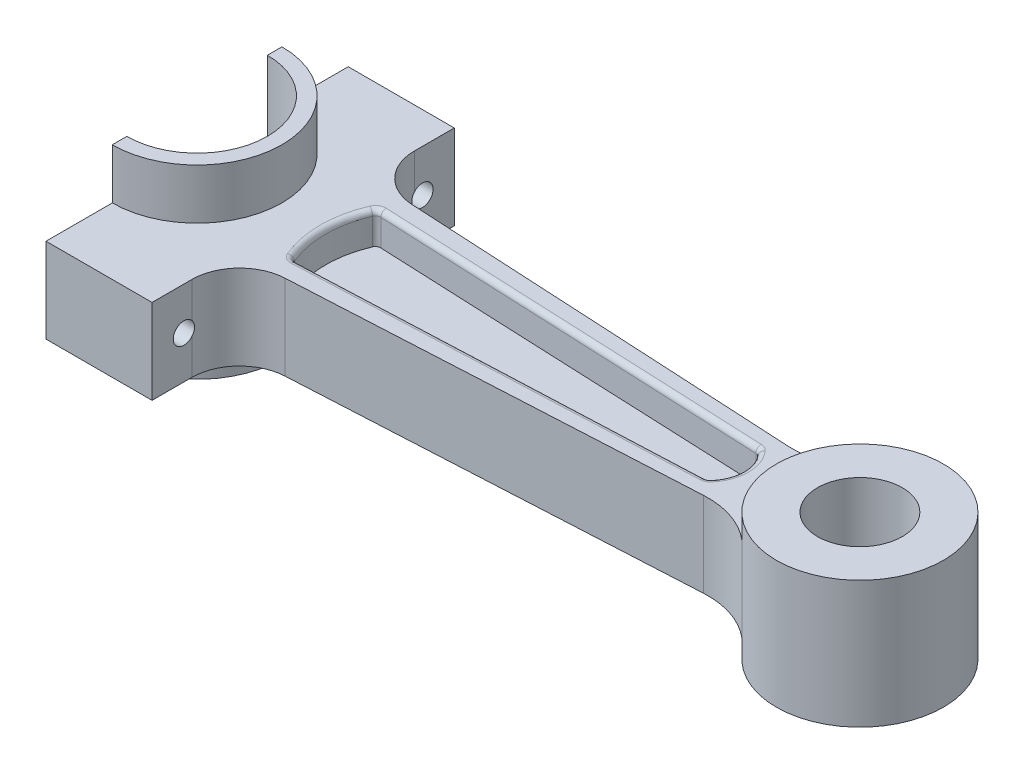
from build123d import *

# Parameters (mm, degrees)
BOSS_EXTRUDE1_DEPTH = 16
SKETCH1_5_R         = 16
BOSS_EXTRUDE2_DEPTH = 24
BOSS_EXTRUDE3_DEPTH = 35
CUT_EXTRUDE1_DEPTH  = 12
FILLET1_R           = 2
FILLET3_R           = 2
SKETCH6_R           = 4
CUT_EXTRUDE4_DEPTH  = 290.336969647


with BuildPart() as part:
    # Sketch1 → Boss-Extrude1 (new, symmetric)
    with BuildSketch(Plane(origin=(0, 0, 0), x_dir=(1, 0, 0), z_dir=(0, 1, 0))):
        with BuildLine():
            Line((-19.774827182, 56.996771876), (-19.774827182, 32))
            ThreePointArc((-19.774827182, 32), (12.225172818, 0), (-19.774827182, -32))
            Line((-19.774827182, -32), (-19.774827182, -56.996771876))
            Line((-19.774827182, -56.996771876), (20.225172818, -56.996771876))
            Line((20.225172818, -56.996771876), (20.225172818, -41.996771876))
            ThreePointArc((20.225172818, -41.996771876), (25.16884807, -29.597039719), (37.287694094, -24))
            Line((37.287694094, -24), (187.287694094, -16))
            ThreePointArc((187.287694094, -16), (199.120008212, -17.668601393), (209.448964206, -23.676975223))
            ThreePointArc((209.448964206, -23.676975223), (198.725172818, 0), (209.448964206, 23.676975223))
            ThreePointArc((209.448964206, 23.676975223), (199.120008212, 17.668601393), (187.287694094, 16))
            Line((187.287694094, 16), (37.287694094, 24))
            ThreePointArc((37.287694094, 24), (25.16884807, 29.597039719), (20.225172818, 41.996771876))
            Line((20.225172818, 41.996771876), (20.225172818, 56.996771876))
            Line((20.225172818, 56.996771876), (-19.774827182, 56.996771876))
        make_face()
    extrude(amount=BOSS_EXTRUDE1_DEPTH, both=True)

    # Sketch1<5> → Boss-Extrude2 (add, symmetric)
    with BuildSketch(Plane(origin=(0, 0, 0), x_dir=(1, 0, 0), z_dir=(0, 1, 0))):
        with BuildLine():
            ThreePointArc((261.725172818, 0), (243.221315105, 28.694081021), (209.448964206, 23.676975223))
            ThreePointArc((209.448964206, 23.676975223), (198.725172818, 0), (209.448964206, -23.676975223))
            ThreePointArc((209.448964206, -23.676975223), (243.221315105, -28.694081021), (261.725172818, 0))
        make_face()
        with Locations((230.225172818, 0)):
            Circle(SKETCH1_5_R, mode=Mode.SUBTRACT)
    extrude(amount=BOSS_EXTRUDE2_DEPTH, both=True)

    # Sketch1<6> → Boss-Extrude3 (add, symmetric)
    with BuildSketch(Plane(origin=(0, 0, 0), x_dir=(1, 0, 0), z_dir=(0, 1, 0))):
        with BuildLine():
            Line((-19.774827182, 32), (-19.774827182, 26.5))
            ThreePointArc((-19.774827182, 26.5), (6.725172818, 0), (-19.774827182, -26.5))
            Line((-19.774827182, -26.5), (-19.774827182, -32))
            ThreePointArc((-19.774827182, -32), (12.225172818, 0), (-19.774827182, 32))
        make_face()
    extrude(amount=BOSS_EXTRUDE3_DEPTH, both=True)

    # Sketch4 → Cut-Extrude1 (cut)
    with BuildSketch(Plane(origin=(0, 16, 0), x_dir=(1, 0, 0), z_dir=(0, 1, 0))):
        with BuildLine():
            Line((32.225172818, -16.001877998), (182.225172818, -9.501877998))
            ThreePointArc((182.225172818, -9.501877998), (186.160979553, 0), (182.225172818, 9.501877998))
            Line((182.225172818, 9.501877998), (32.225172818, 16.001877998))
            ThreePointArc((32.225172818, 16.001877998), (28.665381057, 0), (32.225172818, -16.001877998))
        make_face()
    cut_extrude1 = extrude(amount=-CUT_EXTRUDE1_DEPTH, mode=Mode.SUBTRACT)

    # Fillet1
    fillet1_edges = [part.edges().sort_by_distance(p)[0] for p in [
        (32.225172818, 10, -16.001877998),
        (182.225172818, 10, -9.501877998),
        (32.225172818, 10, 16.001877998),
        (182.225172818, 10, 9.501877998),
        (28.665381057, 16, 0),
        (107.225172818, 16, -12.751877998),
        (186.160979553, 16, 0),
        (107.225172818, 16, 12.751877998),
    ]]
    fillet(fillet1_edges, radius=FILLET1_R)

    # Mirror5: Cut-Extrude1 across plane
    add(cut_extrude1.mirror(Plane.ZX), mode=Mode.SUBTRACT)

    # Fillet3
    fillet3_edges = [part.edges().sort_by_distance(p)[0] for p in [
        (186.160979553, -16, 0),
        (107.225172818, -16, 12.751877998),
        (28.665381057, -16, 0),
        (107.225172818, -16, -12.751877998),
        (32.225172818, -10, 16.001877998),
        (32.225172818, -10, -16.001877998),
        (182.225172818, -10, -9.501877998),
        (182.225172818, -10, 9.501877998),
    ]]
    fillet(fillet3_edges, radius=FILLET3_R)

    # Sketch6 → Cut-Extrude4 (cut, through all)
    with BuildSketch(Plane.ZY.offset(19.774827182)):
        with Locations((-45, 0)):
            Circle(SKETCH6_R)
        with Locations((45, 0)):
            Circle(SKETCH6_R)
    extrude(amount=-CUT_EXTRUDE4_DEPTH, mode=Mode.SUBTRACT)


solid = part.part
